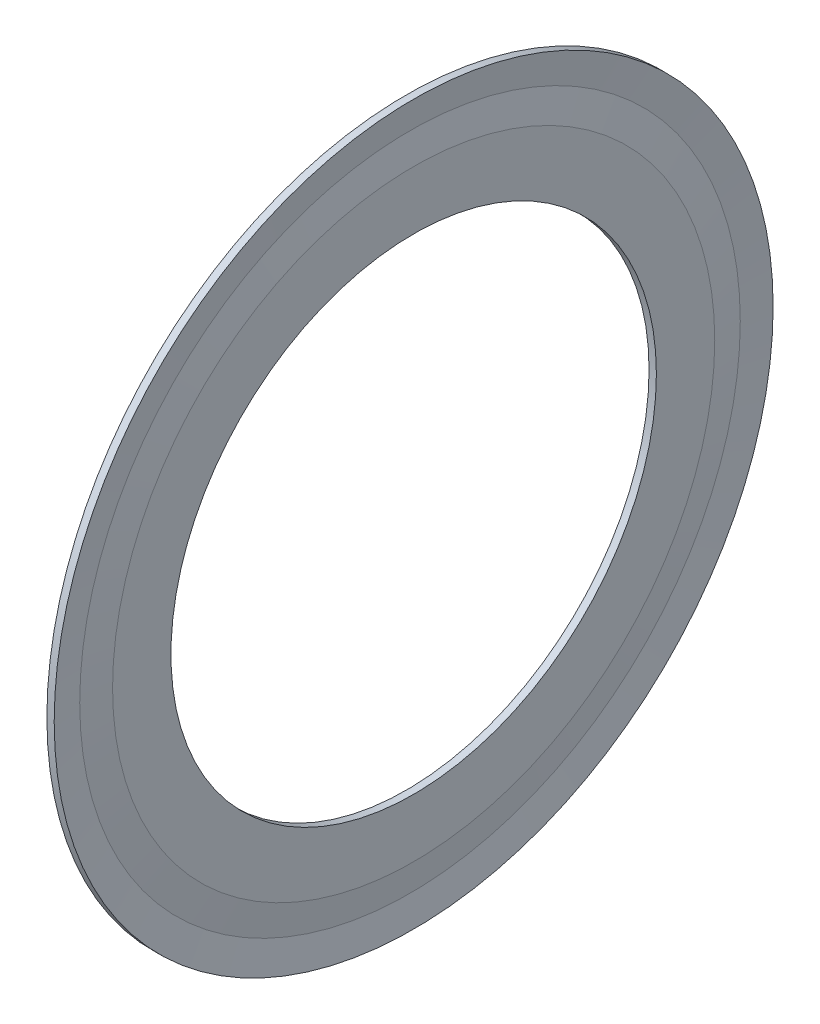
from build123d import *


with BuildPart() as part:
    # Sketch1 → Revolve1 (revolve)
    with BuildSketch(Plane.XY, mode=Mode.PRIVATE) as revolve1_sk:
        Polygon((4.404247, 4.9), (4.523397, 3.95), (4.642547, 3.95), (4.642547, 4.9), (4.582972, 5.375), (4.642547, 5.85), (4.523397, 5.85), (4.404247, 5.352584122), align=None)
    revolve(revolve1_sk.sketch.rotate(Axis((50, 0, 0), (-1, 0, 0)), 90), axis=Axis((50, 0, 0), (-1, 0, 0)))


solid = part.part
